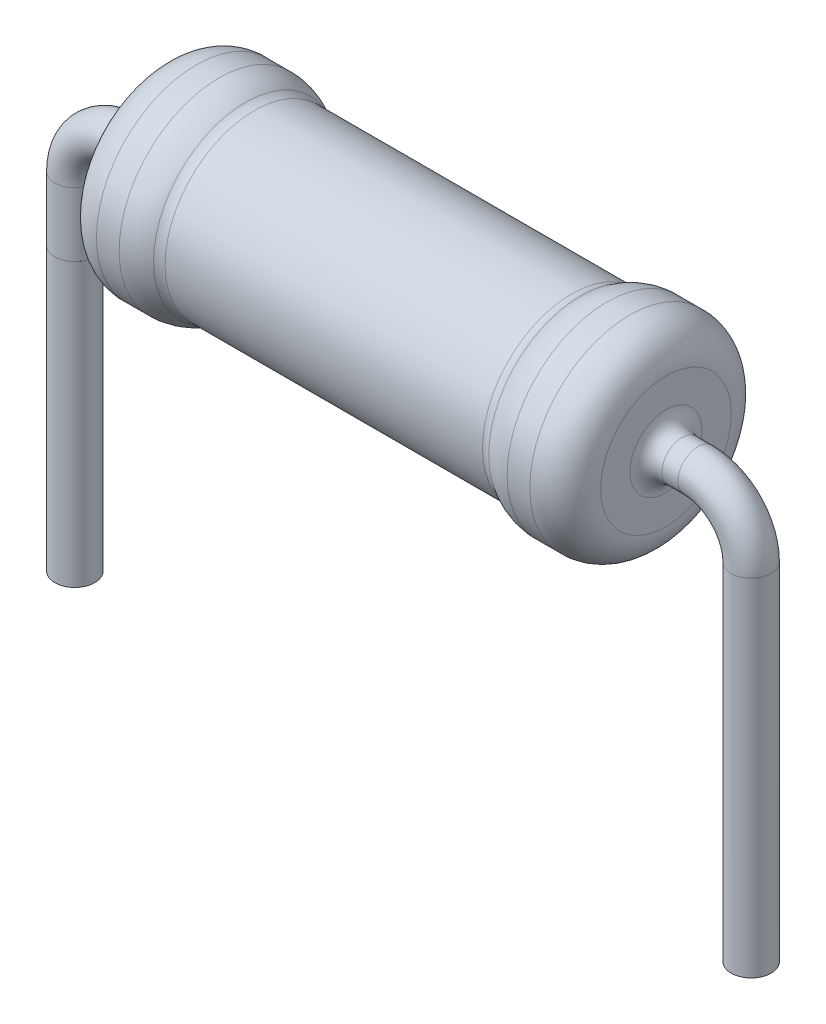
from build123d import *
from build123d.topology import SkipClean

# Parameters (mm, degrees)
SKETCH1_R             = 0.375
BOSS_EXTRUDE1_DEPTH   = 5.3
BOSS_EXTRUDE1_2_DEPTH = 5.3
SKETCH4_R             = 0.375
FILLET2_R             = 0.3


with BuildPart() as part:
    # Sketch1 → Boss-Extrude1 (new body)
    with BuildSketch(Plane(origin=(0, 0, 0), x_dir=(1, 0, 0), z_dir=(0, 1, 0))):
        with Locations(Location((-6.35, 0, 0), (0, 0, 270))):
            Circle(SKETCH1_R)
    extrude(amount=BOSS_EXTRUDE1_DEPTH)


with BuildPart() as body_2:
    # Sketch1 → Boss-Extrude1 2 (new body)
    with BuildSketch(Plane(origin=(0, 0, 0), x_dir=(1, 0, 0), z_dir=(0, 1, 0))):
        with Locations(Location((6.35, 0, 0), (0, 0, 90))):
            Circle(SKETCH1_R)
    extrude(amount=BOSS_EXTRUDE1_2_DEPTH)



with BuildPart() as body_3:
    # Sketch2 → Revolve1 (revolve)
    with BuildSketch(Plane.XY, mode=Mode.PRIVATE) as revolve1_sk:
        with BuildLine():
            Line((4.75, 8.725762057), (4.75, 7.5))
            Line((4.75, 7.5), (-4.75, 7.5))
            Line((-4.75, 7.5), (-4.75, 8.725762057))
            ThreePointArc((-4.75, 8.725762057), (-4.54835659, 9.196374815), (-4.068534253, 9.375))
            Line((-4.068534253, 9.375), (-3.643023528, 9.375))
            ThreePointArc((-3.643023528, 9.375), (-3.383624596, 9.336706926), (-3.146355064, 9.225094499))
            ThreePointArc((-3.146355064, 9.225094499), (-3.06706579, 9.187796544), (-2.98038145, 9.175))
            Line((-2.98038145, 9.175), (2.98038145, 9.175))
            ThreePointArc((2.98038145, 9.175), (3.06706579, 9.187796544), (3.146355064, 9.225094499))
            ThreePointArc((3.146355064, 9.225094499), (3.383624596, 9.336706926), (3.643023528, 9.375))
            Line((3.643023528, 9.375), (4.068534253, 9.375))
            ThreePointArc((4.068534253, 9.375), (4.54835659, 9.196374815), (4.75, 8.725762057))
        make_face()
    revolve(revolve1_sk.sketch.rotate(Axis((-4.75, 7.5, 0), (1, 0, 0)), 90), axis=Axis((-4.75, 7.5, 0), (1, 0, 0)))


with BuildPart() as body_2_1:
    with SkipClean():  # the faces are left unmerged after this step: merging them gives an invalid solid
        add(body_2.part)

        add(body_3.part)  # Sweep1 merges body 3
        # Sweep1: sweep along a path in Sketch3
        with BuildLine(Plane.XY) as sweep1_path:
            Line((3.5, 7.5), (5.35, 7.5))
            ThreePointArc((5.35, 7.5), (6.057106781, 7.207106781), (6.35, 6.5))
            Line((6.35, 6.5), (6.35, 5.3))
        # Sketch4 → Sweep1 (sweep)
        with BuildSketch(Plane(origin=(0, 5.3, 0), x_dir=(1, 0, 0), z_dir=(0, 1, 0))):
            with Locations((6.35, 0)):
                Circle(SKETCH4_R)
        sweep1 = sweep(path=sweep1_path.line)

    # Mirror1: Sweep1 across plane
    with SkipClean():  # the faces are left unmerged after this step: merging them gives an invalid solid
        add(sweep1.mirror(Plane(origin=(0, 0, 0), x_dir=(0, 0, 1), z_dir=(1, 0, 0))))

    # Fillet2
    fillet2_edges = [body_2_1.edges().sort_by_distance(p)[0] for p in [
        (4.75, 7.125, 0),
        (-4.75, 7.125, 0),
    ]]
    fillet(fillet2_edges, radius=FILLET2_R)


solid = Compound([part.part, body_2_1.part])
